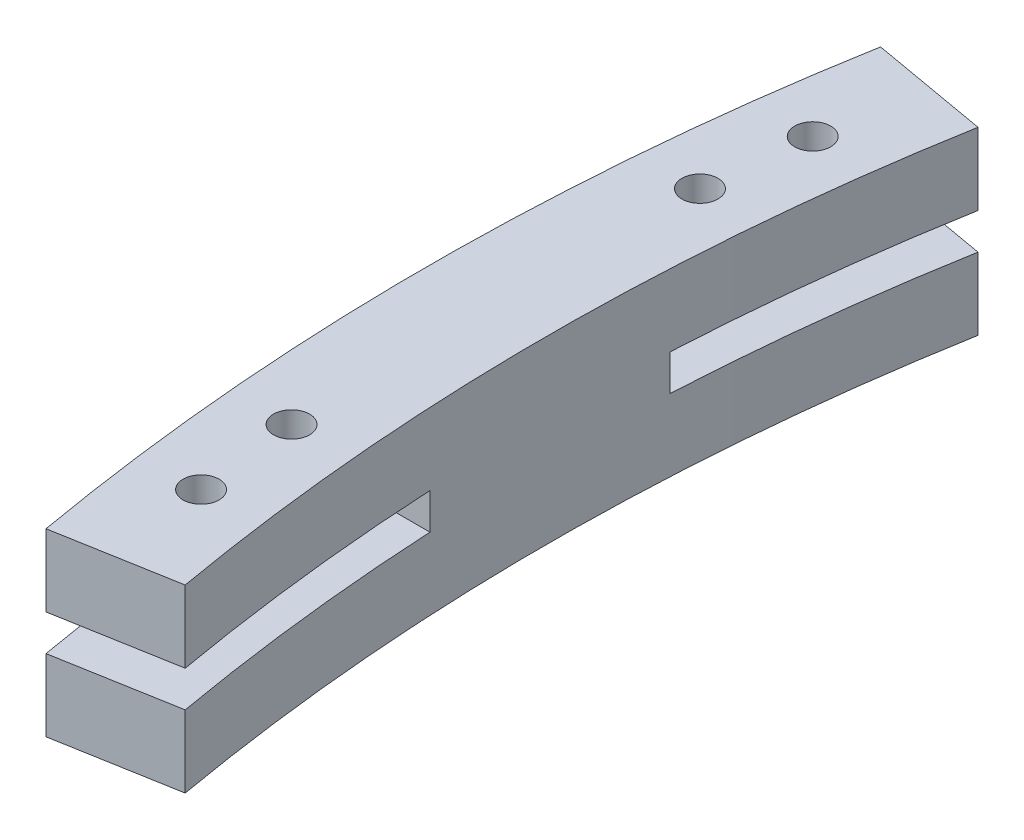
from build123d import *

# Parameters (mm, degrees)
BASE_DEPTH            = 7.5
MOUNT_START           = -1.5
MOUNT_DEPTH           = 3
MOUNT_HOLE_DEPTH      = 204.131478566
MOUNT_HOLE_DEPTH_BACK = 204.131478566
SKETCH12_R            = 1.5
SKETCH14_R            = 1.5
SHAFT_HOLE_DEPTH      = 37.394984425
SKETCH13_W            = 2.5
SKETCH13_H            = 3


with BuildPart() as part:
    # Sketch9 → base (new, symmetric)
    with BuildSketch(Plane(origin=(0, 0, 0), x_dir=(1, 0, 0), z_dir=(0, 1, 0))):
        with BuildLine():
            ThreePointArc((-187.113473072, -32.993153757), (-190, 0), (-187.113473072, 32.993153757))
            Line((-187.113473072, 32.993153757), (-196.961550602, 34.729635533))
            ThreePointArc((-196.961550602, 34.729635533), (-200, 0), (-196.961550602, -34.729635533))
            Line((-196.961550602, -34.729635533), (-187.113473072, -32.993153757))
        make_face()
    extrude(amount=BASE_DEPTH, both=True)

    # Sketch11 → mount (cut)
    with BuildSketch(Plane(origin=(0, 0, 0), x_dir=(1, 0, 0), z_dir=(0, 1, 0)).offset(MOUNT_START)):
        with BuildLine():
            Line((-189.73665961, -10), (-199.749843554, -10))
            ThreePointArc((-199.749843554, -10), (-198.7407137, -22.408228804), (-196.961550602, -34.729635533))
            Line((-196.961550602, -34.729635533), (-187.113473072, -32.993153757))
            ThreePointArc((-187.113473072, -32.993153757), (-188.775466906, -21.536552519), (-189.73665961, -10))
        make_face()
        with BuildLine():
            Line((-189.73665961, 10), (-199.749843554, 10))
            ThreePointArc((-199.749843554, 10), (-198.7407137, 22.408228804), (-196.961550602, 34.729635533))
            Line((-196.961550602, 34.729635533), (-187.113473072, 32.993153757))
            ThreePointArc((-187.113473072, 32.993153757), (-188.775466906, 21.536552519), (-189.73665961, 10))
        make_face()
    extrude(amount=MOUNT_DEPTH, mode=Mode.SUBTRACT)

    # Sketch12 → mount hole (cut, two sides: drawn at the far end of the back side and taken through both)
    with BuildSketch(Plane(origin=(0, 0, 0), x_dir=(1, 0, 0), z_dir=(0, 1, 0)).offset(-MOUNT_HOLE_DEPTH_BACK)):
        with Locations(Location((-193.331747968, 25.452607483, 0), (0, 0, 270))):
            Circle(SKETCH12_R)
        with Locations(Location((-194.257966128, 16.995369836, 0), (0, 0, 270))):
            Circle(SKETCH12_R)
        with Locations(Location((-194.257966128, -16.995369836, 0), (0, 0, 270))):
            Circle(SKETCH12_R)
        with Locations(Location((-193.331747968, -25.452607483, 0), (0, 0, 270))):
            Circle(SKETCH12_R)
    extrude(amount=MOUNT_HOLE_DEPTH + MOUNT_HOLE_DEPTH_BACK, mode=Mode.SUBTRACT)

    # Sketch14 → shaft hole (cut, through all)
    with BuildSketch(Plane.ZY.offset(195)):
        with Locations(Location((0, 0, 0), (0, 0, 90))):
            Circle(SKETCH14_R)
    extrude(amount=SHAFT_HOLE_DEPTH, mode=Mode.SUBTRACT)

    # Sketch13 → bearing hole (revolve, cut)
    with BuildSketch(Plane(origin=(0, 0, 0), x_dir=(1, 0, 0), z_dir=(0, 1, 0)), mode=Mode.PRIVATE) as bearing_hole_sk:
        with Locations((-195, 1.5)):
            Rectangle(SKETCH13_W, SKETCH13_H)
    revolve(bearing_hole_sk.sketch.rotate(Axis((0, 0, 0), (-1, 0, 0)), 270), axis=Axis((0, 0, 0), (-1, 0, 0)), mode=Mode.SUBTRACT)


solid = part.part
